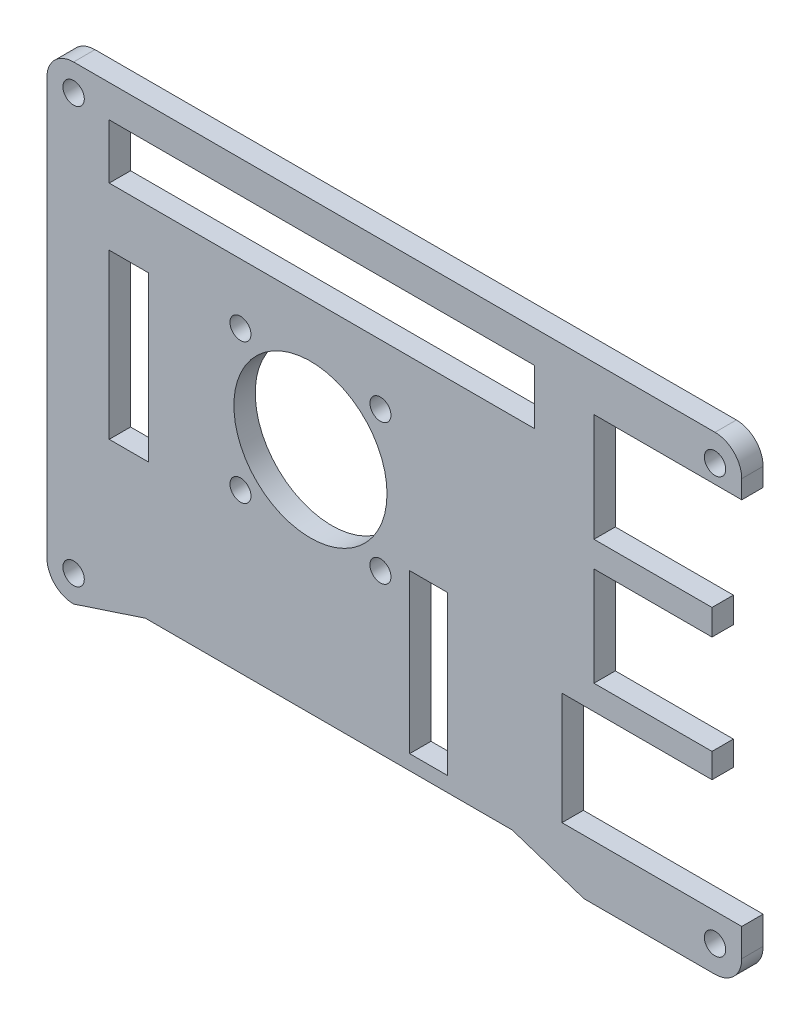
from build123d import *

# Parameters (mm, degrees)
SKETCH1_R           = 1.524
SKETCH1_W           = 60.6932
SKETCH1_H           = 7.81
SKETCH1_W_2         = 5.588
SKETCH1_H_2         = 23.368
SKETCH1_W_3         = 5.4034
SKETCH1_H_3         = 22.6066
BOSS_EXTRUDE1_DEPTH = 3.048
SKETCH2_R           = 10.922
SKETCH2_R_2         = 1.4986
CUT_EXTRUDE1_DEPTH  = 72.310891511


with BuildPart() as part:
    # Sketch1 → Boss-Extrude1 (new body)
    with BuildSketch(Plane.XY):
        with BuildLine():
            Line((61.214907375, 24.068294304), (40.134807375, 24.068294304))
            Line((40.134807375, 24.068294304), (40.134807375, 8.658194304))
            Line((40.134807375, 8.658194304), (56.975007375, 8.658194304))
            Line((56.975007375, 8.658194304), (56.975007375, 4.997894304))
            Line((56.975007375, 4.997894304), (40.134807375, 4.997894304))
            Line((40.134807375, 4.997894304), (40.134807375, -9.121805696))
            Line((40.134807375, -9.121805696), (56.975007375, -9.121805696))
            Line((56.975007375, -9.121805696), (56.975007375, -12.628005696))
            Line((56.975007375, -12.628005696), (35.575007375, -12.628005696))
            Line((35.575007375, -12.628005696), (35.575007375, -28.627805696))
            Line((35.575007375, -28.627805696), (61.214907375, -28.627805696))
            Line((61.214907375, -28.627805696), (61.214907375, -32.613401529))
            ThreePointArc((61.214907375, -32.613401529), (60.108826144, -35.325305244), (57.405007375, -36.451005696))
            Line((57.405007375, -36.451005696), (38.714307375, -36.451005696))
            Line((38.714307375, -36.451005696), (28.474307375, -33.084405696))
            Line((28.474307375, -33.084405696), (-23.844892625, -33.084405696))
            Line((-23.844892625, -33.084405696), (-34.084892625, -36.451005696))
            ThreePointArc((-34.084892625, -36.451005696), (-36.778969461, -35.335082532), (-37.894892625, -32.641005696))
            Line((-37.894892625, -32.641005696), (-37.894892625, 26.697694304))
            ThreePointArc((-37.894892625, 26.697694304), (-36.778969461, 29.391771141), (-34.084892625, 30.507694304))
            Line((-34.084892625, 30.507694304), (57.404932375, 30.507694304))
            ThreePointArc((57.404932375, 30.507694304), (60.103884597, 29.386886916), (61.214907375, 26.683892153))
            Line((61.214907375, 26.683892153), (61.214907375, 24.068294304))
        make_face()
        with Locations(Location((57.405007375, -32.641005696, 0), (0, 0, 180))):
            Circle(SKETCH1_R, mode=Mode.SUBTRACT)
        with Locations(Location((-34.084892625, -32.641005696, 0), (0, 0, 180))):
            Circle(SKETCH1_R, mode=Mode.SUBTRACT)
        with Locations(Location((-34.084892625, 26.697694304, 0), (0, 0, 180))):
            Circle(SKETCH1_R, mode=Mode.SUBTRACT)
        with Locations(Location((57.404932375, 26.697694304, 0), (0, 0, 180))):
            Circle(SKETCH1_R, mode=Mode.SUBTRACT)
        with Locations((1.341707375, 21.991994304)):
            Rectangle(SKETCH1_W, SKETCH1_H, mode=Mode.SUBTRACT)
        with Locations((-26.210892625, -1.882805696)):
            Rectangle(SKETCH1_W_2, SKETCH1_H_2, mode=Mode.SUBTRACT)
        with Locations((16.546707375, -19.663505696)):
            Rectangle(SKETCH1_W_3, SKETCH1_H_3, mode=Mode.SUBTRACT)
    extrude(amount=BOSS_EXTRUDE1_DEPTH)

    # Sketch2 → Cut-Extrude1 (cut, through all)
    with BuildSketch(Plane.XY.offset(3.048)):
        with Locations((-0.302892625, -0.480305696)):
            Circle(SKETCH2_R)
        with Locations((-10.285092625, -10.462505696)):
            Circle(SKETCH2_R_2)
        with Locations((-10.285092625, 9.501894304)):
            Circle(SKETCH2_R_2)
        with Locations((9.679307375, -10.462505696)):
            Circle(SKETCH2_R_2)
        with Locations((9.679307375, 9.501894304)):
            Circle(SKETCH2_R_2)
    extrude(amount=-CUT_EXTRUDE1_DEPTH, mode=Mode.SUBTRACT)


solid = part.part
